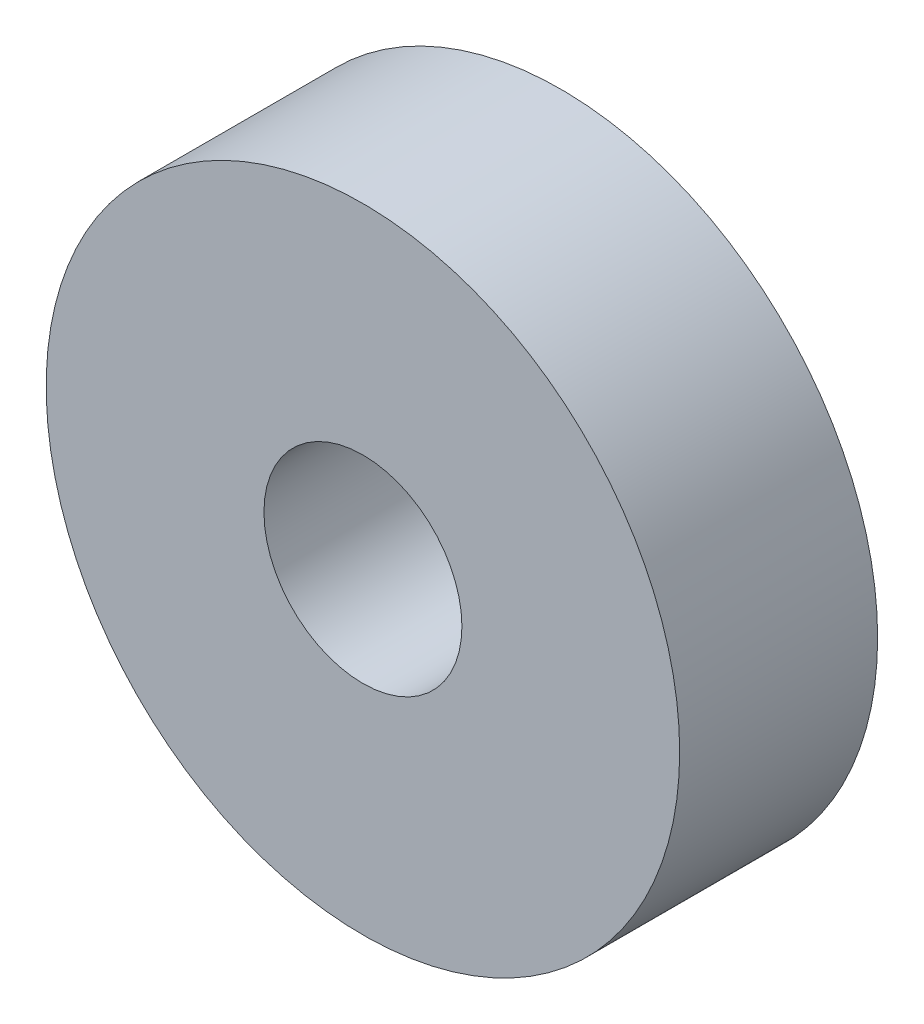
from build123d import *

# Parameters (mm, degrees)
ESQUISSE1_R             = 8
BOSS_EXTRU_1_DEPTH      = 5
ESQUISSE2_R             = 2.5
ENL_V_MAT_EXTRU_1_DEPTH = 5


with BuildPart() as part:
    # Esquisse1 → Boss.-Extru.1 (new body)
    with BuildSketch(Plane.XY):
        Circle(ESQUISSE1_R)
    extrude(amount=BOSS_EXTRU_1_DEPTH)

    # Esquisse2 → Enlèv. mat.-Extru.1 (cut)
    with BuildSketch(Plane.XY.offset(5)):
        Circle(ESQUISSE2_R)
    extrude(amount=-ENL_V_MAT_EXTRU_1_DEPTH, mode=Mode.SUBTRACT)


solid = part.part
